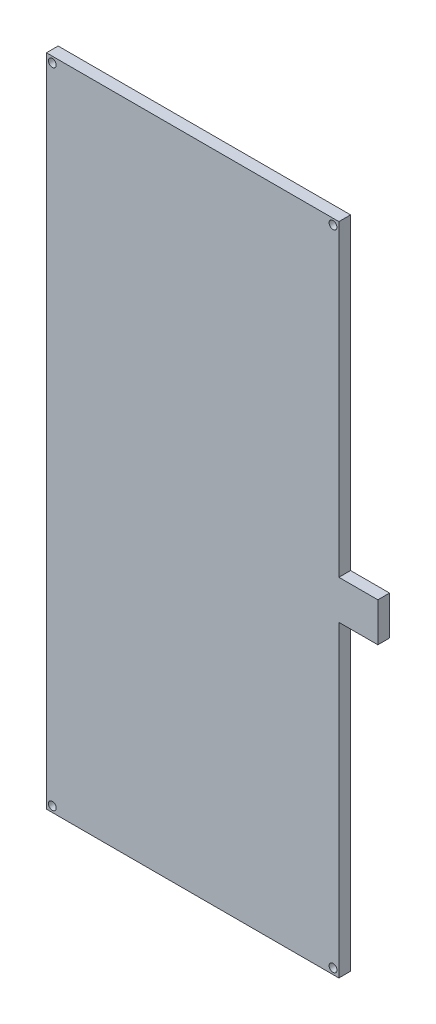
from build123d import *

# Parameters (mm, degrees)
SKETCH1_W           = 75
SKETCH1_H           = 168
BOSS_EXTRUDE1_DEPTH = 3
SKETCH2_R           = 1
CUT_EXTRUDE1_DEPTH  = 93.03939374
SKETCH3_W           = 10
SKETCH3_H           = 10
BOSS_EXTRUDE2_DEPTH = 3


with BuildPart() as part:
    # Sketch1 → Boss-Extrude1 (new body)
    with BuildSketch(Plane.XY):
        Rectangle(SKETCH1_W, SKETCH1_H)
    extrude(amount=BOSS_EXTRUDE1_DEPTH)

    # Sketch2 → Cut-Extrude1 (cut, through all)
    with BuildSketch(Plane.XY.offset(3)):
        with Locations((36, 82.5)):
            Circle(SKETCH2_R)
        with Locations(Location((-36, 82.5, 0), (0, 0, 180))):
            Circle(SKETCH2_R)
        with Locations(Location((36, -82.5, 0), (0, 0, 180))):
            Circle(SKETCH2_R)
        with Locations((-36, -82.5)):
            Circle(SKETCH2_R)
    extrude(amount=-CUT_EXTRUDE1_DEPTH, mode=Mode.SUBTRACT)

    # Sketch3 → Boss-Extrude2 (add)
    with BuildSketch(Plane.XY.offset(3)):
        with Locations((42.5, 0)):
            Rectangle(SKETCH3_W, SKETCH3_H)
    extrude(amount=-BOSS_EXTRUDE2_DEPTH)


solid = part.part
